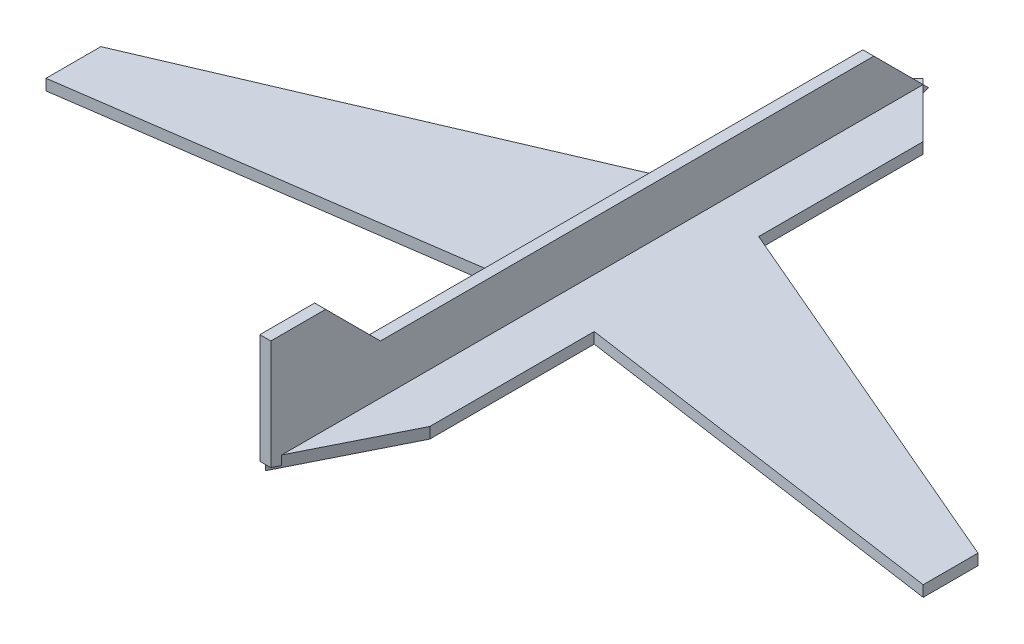
from build123d import *

# Parameters (mm, degrees)
BOSS_EXTRUDE1_DEPTH      = 0.1
BOSS_EXTRUDE1_DEPTH_BACK = 0.1
BOSS_EXTRUDE2_DEPTH      = 0.1
BOSS_EXTRUDE2_DEPTH_BACK = 0.1


with BuildPart() as part:
    # Sketch1 → Boss-Extrude1 (new, two sides: drawn at the far end of the back side and taken through both)
    with BuildSketch(Plane(origin=(0, 0, 0), x_dir=(1, 0, 0), z_dir=(0, 1, 0)).offset(-BOSS_EXTRUDE1_DEPTH_BACK)):
        Polygon((1, 4), (0, 5), (-1, 4), (-1, 1), (-8, -2), (-8, -3), (-1, -2), (-1, -5), (0, -7), (1, -5), (1, -2), (8, -3), (8, -2), (1, 1), align=None)
    extrude(amount=BOSS_EXTRUDE1_DEPTH + BOSS_EXTRUDE1_DEPTH_BACK)

    # Sketch2 → Boss-Extrude2 (add, two sides: drawn at the far end of the back side and taken through both)
    with BuildSketch(Plane(origin=(0, 0, 0), x_dir=(0, 0, -1), z_dir=(1, 0, 0)).offset(-BOSS_EXTRUDE2_DEPTH_BACK)):
        Polygon((5, 0), (4, 1), (-5, 1), (-6, 2), (-7, 2), (-7, 0), (-4, -1), (2, -1), align=None)
    extrude(amount=BOSS_EXTRUDE2_DEPTH + BOSS_EXTRUDE2_DEPTH_BACK)


solid = part.part
